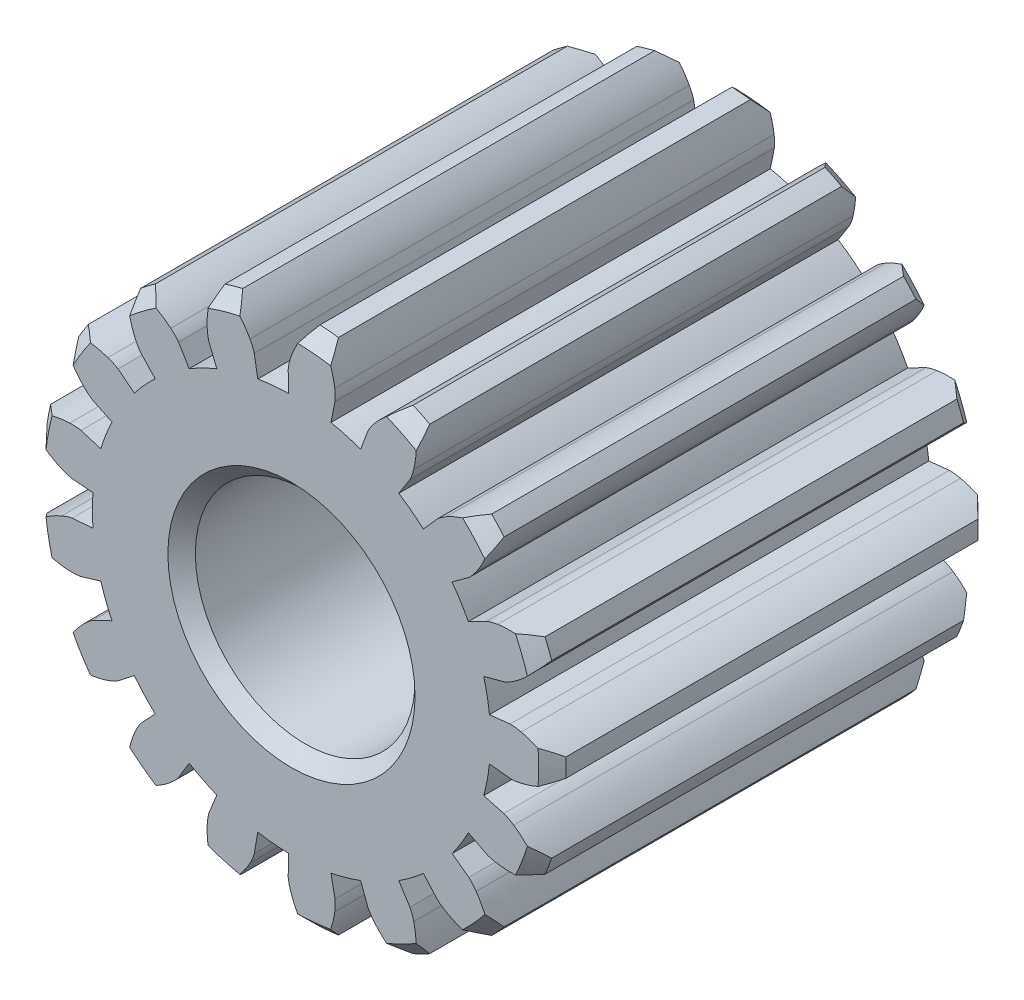
from build123d import *

# Parameters (mm, degrees)
MODEL_R             = 2
BOSS_EXTRUDE1_DEPTH = 8
CHAMFER1_SIZE       = 0.25
CHAMFER2_SIZE       = 0.25


with BuildPart() as part:
    # Model → Boss-Extrude1 (new body)
    with BuildSketch(Plane.XY):
        with BuildLine():
            Line((3.604185328, -0.387908651), (3.979276599, -0.428278703))
            add(Edge.make_bspline(
                [(3.979276599, -0.428278703), (4.001745096, -0.429226432), (4.069327024, -0.429175741), (4.182275047, -0.404282392)],
                knots=[0, 0, 0, 0, 1, 1, 1, 1], degree=3))
            add(Edge.make_bspline(
                [(4.182275047, -0.404282392), (4.317212789, -0.374010467), (4.510838803, -0.308553994), (4.747597513, -0.168282073)],
                knots=[0, 0, 0, 0, 1, 1, 1, 1], degree=3))
            ThreePointArc((4.747597513, -0.168282073), (4.750579017, 0), (4.747597513, 0.168282073))
            add(Edge.make_bspline(
                [(4.747597513, 0.168282073), (4.510838803, 0.308553994), (4.317212789, 0.374010467), (4.182275047, 0.404282392)],
                knots=[0, 0, 0, 0, 1, 1, 1, 1], degree=3))
            add(Edge.make_bspline(
                [(4.182275047, 0.404282392), (4.069327024, 0.429175741), (4.001745096, 0.429226432), (3.979276599, 0.428278703)],
                knots=[0, 0, 0, 0, 1, 1, 1, 1], degree=3))
            Line((3.979276599, 0.428278703), (3.604185328, 0.387908651))
            ThreePointArc((3.604185328, 0.387908651), (3.563277486, 0.666092002), (3.500931495, 0.940267868))
            Line((3.500931495, 0.940267868), (3.865277034, 1.038122512))
            add(Edge.make_bspline(
                [(3.865277034, 1.038122512), (3.886570643, 1.045355338), (3.949570602, 1.069816015), (4.045898982, 1.133829903)],
                knots=[0, 0, 0, 0, 1, 1, 1, 1], degree=3))
            add(Edge.make_bspline(
                [(4.045898982, 1.133829903), (4.160789199, 1.210802767), (4.317694474, 1.341784894), (4.487793334, 1.558111676)],
                knots=[0, 0, 0, 0, 1, 1, 1, 1], degree=3))
            ThreePointArc((4.487793334, 1.558111676), (4.429783007, 1.71610708), (4.366212341, 1.871948396))
            add(Edge.make_bspline(
                [(4.366212341, 1.871948396), (4.094769356, 1.917220956), (3.89057287, 1.908311516), (3.753811692, 1.88779411)],
                knots=[0, 0, 0, 0, 1, 1, 1, 1], degree=3))
            add(Edge.make_bspline(
                [(3.753811692, 1.88779411), (3.639498283, 1.870204934), (3.576461699, 1.845838794), (3.55585281, 1.836838506)],
                knots=[0, 0, 0, 0, 1, 1, 1, 1], degree=3))
            Line((3.55585281, 1.836838506), (3.220673961, 1.663695958))
            ThreePointArc((3.220673961, 1.663695958), (3.082037117, 1.90831659), (2.924857465, 2.141456002))
            Line((2.924857465, 2.141456002), (3.229250388, 2.364319529))
            add(Edge.make_bspline(
                [(3.229250388, 2.364319529), (3.246493288, 2.378756077), (3.296402785, 2.424323189), (3.363101841, 2.518812187)],
                knots=[0, 0, 0, 0, 1, 1, 1, 1], degree=3))
            add(Edge.make_bspline(
                [(3.363101841, 2.518812187), (3.442427971, 2.632090378), (3.541421581, 2.810908298), (3.621887797, 3.07407381)],
                knots=[0, 0, 0, 0, 1, 1, 1, 1], degree=3))
            ThreePointArc((3.621887797, 3.07407381), (3.510720256, 3.200444389), (3.395145998, 3.322797715))
            add(Edge.make_bspline(
                [(3.395145998, 3.322797715), (3.125678618, 3.266956604), (2.938489526, 3.184884519), (2.818375267, 3.116348773)],
                knots=[0, 0, 0, 0, 1, 1, 1, 1], degree=3))
            add(Edge.make_bspline(
                [(2.818375267, 3.116348773), (2.718135131, 3.058652588), (2.668157332, 3.013160399), (2.652191395, 2.997323091)],
                knots=[0, 0, 0, 0, 1, 1, 1, 1], degree=3))
            Line((2.652191395, 2.997323091), (2.402192728, 2.714791907))
            ThreePointArc((2.402192728, 2.714791907), (2.184550557, 2.892812449), (1.953765227, 3.053428637))
            Line((1.953765227, 3.053428637), (2.157095582, 3.371202093))
            add(Edge.make_bspline(
                [(2.157095582, 3.371202093), (2.167959025, 3.390892627), (2.198037506, 3.451412083), (2.22609916, 3.563614928)],
                knots=[0, 0, 0, 0, 1, 1, 1, 1], degree=3))
            add(Edge.make_bspline(
                [(2.22609916, 3.563614928), (2.259147771, 3.697899599), (2.28686008, 3.90040296), (2.266826244, 4.174865241)],
                knots=[0, 0, 0, 0, 1, 1, 1, 1], degree=3))
            ThreePointArc((2.266826244, 4.174865241), (2.11751528, 4.252543949), (1.965546375, 4.32488479))
            add(Edge.make_bspline(
                [(1.965546375, 4.32488479), (1.734447662, 4.175471659), (1.589546889, 4.031321221), (1.502301646, 3.924023265)],
                knots=[0, 0, 0, 0, 1, 1, 1, 1], degree=3))
            add(Edge.make_bspline(
                [(1.502301646, 3.924023265), (1.429672768, 3.834012262), (1.399503533, 3.773537995), (1.390336835, 3.753002583)],
                knots=[0, 0, 0, 0, 1, 1, 1, 1], degree=3))
            Line((1.390336835, 3.753002583), (1.259282057, 3.399240165))
            ThreePointArc((1.259282057, 3.399240165), (0.992028339, 3.486617957), (0.718806169, 3.553018814))
            Line((0.718806169, 3.553018814), (0.793613065, 3.922785134))
            add(Edge.make_bspline(
                [(0.793613065, 3.922785134), (0.796629883, 3.945070338), (0.802815081, 4.012368651), (0.788449452, 4.127131726)],
                knots=[0, 0, 0, 0, 1, 1, 1, 1], degree=3))
            add(Edge.make_bspline(
                [(0.788449452, 4.127131726), (0.770757146, 4.264286988), (0.723445453, 4.463126589), (0.605617245, 4.711817988)],
                knots=[0, 0, 0, 0, 1, 1, 1, 1], degree=3))
            ThreePointArc((0.605617245, 4.711817988), (0.438328132, 4.730313885), (0.270488822, 4.74287221))
            add(Edge.make_bspline(
                [(0.270488822, 4.74287221), (0.108969939, 4.520066131), (0.025927137, 4.333305653), (-0.016666138, 4.201736672)],
                knots=[0, 0, 0, 0, 1, 1, 1, 1], degree=3))
            add(Edge.make_bspline(
                [(-0.016666138, 4.201736672), (-0.051874824, 4.091567334), (-0.058160973, 4.024278375), (-0.059290418, 4.00181828)],
                knots=[0, 0, 0, 0, 1, 1, 1, 1], degree=3))
            Line((-0.059290418, 4.00181828), (-0.053701634, 3.624602204))
            ThreePointArc((-0.053701634, 3.624602204), (-0.334472803, 3.609536389), (-0.613231646, 3.572754113))
            Line((-0.613231646, 3.572754113), (-0.677051293, 3.944574305))
            add(Edge.make_bspline(
                [(-0.677051293, 3.944574305), (-0.682288539, 3.966444439), (-0.700831968, 4.031432599), (-0.755684723, 4.133256515)],
                knots=[0, 0, 0, 0, 1, 1, 1, 1], degree=3))
            add(Edge.make_bspline(
                [(-0.755684723, 4.133256515), (-0.821728502, 4.254758791), (-0.937674491, 4.423080241), (-1.137383718, 4.612413607)],
                knots=[0, 0, 0, 0, 1, 1, 1, 1], degree=3))
            ThreePointArc((-1.137383718, 4.612413607), (-1.300057658, 4.569228719), (-1.461099744, 4.520308456))
            add(Edge.make_bspline(
                [(-1.461099744, 4.520308456), (-1.531224778, 4.254200624), (-1.541194219, 4.050053145), (-1.533383067, 3.911982259)],
                knots=[0, 0, 0, 0, 1, 1, 1, 1], degree=3))
            add(Edge.make_bspline(
                [(-1.533383067, 3.911982259), (-1.526416434, 3.796533566), (-1.507970518, 3.731517662), (-1.500910172, 3.710166244)],
                knots=[0, 0, 0, 0, 1, 1, 1, 1], degree=3))
            Line((-1.500910172, 3.710166244), (-1.359432621, 3.36044163))
            ThreePointArc((-1.359432621, 3.36044163), (-1.61580154, 3.244966931), (-1.862449128, 3.109969171))
            Line((-1.862449128, 3.109969171), (-2.056276123, 3.433626859))
            add(Edge.make_bspline(
                [(-2.056276123, 3.433626859), (-2.069060113, 3.452128241), (-2.109827777, 3.506029235), (-2.197759488, 3.581162109)],
                knots=[0, 0, 0, 0, 1, 1, 1, 1], degree=3))
            add(Edge.make_bspline(
                [(-2.197759488, 3.581162109), (-2.303235163, 3.670601842), (-2.472156299, 3.785672398), (-2.726774707, 3.890077209)],
                knots=[0, 0, 0, 0, 1, 1, 1, 1], degree=3))
            ThreePointArc((-2.726774707, 3.890077209), (-2.862863459, 3.791043895), (-2.995358694, 3.687251997))
            add(Edge.make_bspline(
                [(-2.995358694, 3.687251997), (-2.964619104, 3.41378175), (-2.900168756, 3.219818518), (-2.843008116, 3.093892964)],
                knots=[0, 0, 0, 0, 1, 1, 1, 1], degree=3))
            add(Edge.make_bspline(
                [(-2.843008116, 3.093892964), (-2.794807046, 2.988756902), (-2.754120288, 2.93479481), (-2.73982369, 2.917435698)],
                knots=[0, 0, 0, 0, 1, 1, 1, 1], degree=3))
            Line((-2.73982369, 2.917435698), (-2.481564701, 2.642434793))
            ThreePointArc((-2.481564701, 2.642434793), (-2.678907325, 2.442146708), (-2.860132536, 2.22716566))
            Line((-2.860132536, 2.22716566), (-3.157789469, 2.458949079))
            add(Edge.make_bspline(
                [(-3.157789469, 2.458949079), (-3.176393654, 2.471582994), (-3.233879653, 2.507117196), (-3.343014657, 2.545411916)],
                knots=[0, 0, 0, 0, 1, 1, 1, 1], degree=3))
            add(Edge.make_bspline(
                [(-3.343014657, 2.545411916), (-3.473677153, 2.590709775), (-3.6727597, 2.63698852), (-3.947899663, 2.642364329)],
                knots=[0, 0, 0, 0, 1, 1, 1, 1], degree=3))
            ThreePointArc((-3.947899663, 2.642364329), (-4.039023685, 2.500857587), (-4.125077855, 2.356211725))
            add(Edge.make_bspline(
                [(-4.125077855, 2.356211725), (-3.997625193, 2.112312734), (-3.867459431, 1.954729558), (-3.768669166, 1.857956281)],
                knots=[0, 0, 0, 0, 1, 1, 1, 1], degree=3))
            add(Edge.make_bspline(
                [(-3.768669166, 1.857956281), (-3.68574348, 1.777332058), (-3.628310852, 1.741711658), (-3.608708837, 1.730689295)],
                knots=[0, 0, 0, 0, 1, 1, 1, 1], degree=3))
            Line((-3.608708837, 1.730689295), (-3.268547716, 1.567552495))
            ThreePointArc((-3.268547716, 1.567552495), (-3.380211832, 1.30950104), (-3.471539196, 1.043571085))
            Line((-3.471539196, 1.043571085), (-3.832825848, 1.152176601))
            add(Edge.make_bspline(
                [(-3.832825848, 1.152176601), (-3.854737631, 1.157236769), (-3.921178163, 1.169605087), (-4.036777172, 1.16588974)],
                knots=[0, 0, 0, 0, 1, 1, 1, 1], degree=3))
            add(Edge.make_bspline(
                [(-4.036777172, 1.16588974), (-4.174979794, 1.160927997), (-4.377336553, 1.132164731), (-4.635838893, 1.037785505)],
                knots=[0, 0, 0, 0, 1, 1, 1, 1], degree=3))
            ThreePointArc((-4.635838893, 1.037785505), (-4.669691382, 0.872916604), (-4.697682393, 0.706952003))
            add(Edge.make_bspline(
                [(-4.697682393, 0.706952003), (-4.490729848, 0.525564179), (-4.31242828, 0.42564354), (-4.185350561, 0.371092307)],
                knots=[0, 0, 0, 0, 1, 1, 1, 1], degree=3))
            add(Edge.make_bspline(
                [(-4.185350561, 0.371092307), (-4.078899834, 0.32586867), (-4.012477931, 0.313400695), (-3.990217859, 0.310203712)],
                knots=[0, 0, 0, 0, 1, 1, 1, 1], degree=3))
            Line((-3.990217859, 0.310203712), (-3.614095251, 0.280963547))
            ThreePointArc((-3.614095251, 0.280963547), (-3.625, 0), (-3.614095251, -0.280963547))
            Line((-3.614095251, -0.280963547), (-3.990217859, -0.310203712))
            add(Edge.make_bspline(
                [(-3.990217859, -0.310203712), (-4.012477931, -0.313400695), (-4.078899834, -0.32586867), (-4.185350561, -0.371092307)],
                knots=[0, 0, 0, 0, 1, 1, 1, 1], degree=3))
            add(Edge.make_bspline(
                [(-4.185350561, -0.371092307), (-4.31242828, -0.42564354), (-4.490729848, -0.525564179), (-4.697682393, -0.706952003)],
                knots=[0, 0, 0, 0, 1, 1, 1, 1], degree=3))
            ThreePointArc((-4.697682393, -0.706952003), (-4.669691382, -0.872916604), (-4.635838893, -1.037785505))
            add(Edge.make_bspline(
                [(-4.635838893, -1.037785505), (-4.377336553, -1.132164731), (-4.174979794, -1.160927997), (-4.036777172, -1.16588974)],
                knots=[0, 0, 0, 0, 1, 1, 1, 1], degree=3))
            add(Edge.make_bspline(
                [(-4.036777172, -1.16588974), (-3.921178163, -1.169605087), (-3.854737631, -1.157236769), (-3.832825848, -1.152176601)],
                knots=[0, 0, 0, 0, 1, 1, 1, 1], degree=3))
            Line((-3.832825848, -1.152176601), (-3.471539196, -1.043571085))
            ThreePointArc((-3.471539196, -1.043571085), (-3.380211832, -1.30950104), (-3.268547716, -1.567552495))
            Line((-3.268547716, -1.567552495), (-3.608708837, -1.730689295))
            add(Edge.make_bspline(
                [(-3.608708837, -1.730689295), (-3.628310852, -1.741711658), (-3.68574348, -1.777332058), (-3.768669166, -1.857956281)],
                knots=[0, 0, 0, 0, 1, 1, 1, 1], degree=3))
            add(Edge.make_bspline(
                [(-3.768669166, -1.857956281), (-3.867459431, -1.954729558), (-3.997625193, -2.112312734), (-4.125077855, -2.356211725)],
                knots=[0, 0, 0, 0, 1, 1, 1, 1], degree=3))
            ThreePointArc((-4.125077855, -2.356211725), (-4.039023685, -2.500857587), (-3.947899663, -2.642364329))
            add(Edge.make_bspline(
                [(-3.947899663, -2.642364329), (-3.6727597, -2.63698852), (-3.473677153, -2.590709775), (-3.343014657, -2.545411916)],
                knots=[0, 0, 0, 0, 1, 1, 1, 1], degree=3))
            add(Edge.make_bspline(
                [(-3.343014657, -2.545411916), (-3.233879653, -2.507117196), (-3.176393654, -2.471582994), (-3.157789469, -2.458949079)],
                knots=[0, 0, 0, 0, 1, 1, 1, 1], degree=3))
            Line((-3.157789469, -2.458949079), (-2.860132536, -2.22716566))
            ThreePointArc((-2.860132536, -2.22716566), (-2.678907325, -2.442146708), (-2.481564701, -2.642434793))
            Line((-2.481564701, -2.642434793), (-2.73982369, -2.917435698))
            add(Edge.make_bspline(
                [(-2.73982369, -2.917435698), (-2.754120288, -2.93479481), (-2.794807046, -2.988756902), (-2.843008116, -3.093892964)],
                knots=[0, 0, 0, 0, 1, 1, 1, 1], degree=3))
            add(Edge.make_bspline(
                [(-2.843008116, -3.093892964), (-2.900168756, -3.219818518), (-2.964619104, -3.41378175), (-2.995358694, -3.687251997)],
                knots=[0, 0, 0, 0, 1, 1, 1, 1], degree=3))
            ThreePointArc((-2.995358694, -3.687251997), (-2.862863459, -3.791043895), (-2.726774707, -3.890077209))
            add(Edge.make_bspline(
                [(-2.726774707, -3.890077209), (-2.472156299, -3.785672398), (-2.303235163, -3.670601842), (-2.197759488, -3.581162109)],
                knots=[0, 0, 0, 0, 1, 1, 1, 1], degree=3))
            add(Edge.make_bspline(
                [(-2.197759488, -3.581162109), (-2.109827777, -3.506029235), (-2.069060113, -3.452128241), (-2.056276123, -3.433626859)],
                knots=[0, 0, 0, 0, 1, 1, 1, 1], degree=3))
            Line((-2.056276123, -3.433626859), (-1.862449128, -3.109969171))
            ThreePointArc((-1.862449128, -3.109969171), (-1.61580154, -3.244966931), (-1.359432621, -3.36044163))
            Line((-1.359432621, -3.36044163), (-1.500910172, -3.710166244))
            add(Edge.make_bspline(
                [(-1.500910172, -3.710166244), (-1.507970518, -3.731517662), (-1.526416434, -3.796533566), (-1.533383067, -3.911982259)],
                knots=[0, 0, 0, 0, 1, 1, 1, 1], degree=3))
            add(Edge.make_bspline(
                [(-1.533383067, -3.911982259), (-1.541194219, -4.050053145), (-1.531224778, -4.254200624), (-1.461099744, -4.520308456)],
                knots=[0, 0, 0, 0, 1, 1, 1, 1], degree=3))
            ThreePointArc((-1.461099744, -4.520308456), (-1.300057658, -4.569228719), (-1.137383718, -4.612413607))
            add(Edge.make_bspline(
                [(-1.137383718, -4.612413607), (-0.937674491, -4.423080241), (-0.821728502, -4.254758791), (-0.755684723, -4.133256515)],
                knots=[0, 0, 0, 0, 1, 1, 1, 1], degree=3))
            add(Edge.make_bspline(
                [(-0.755684723, -4.133256515), (-0.700831968, -4.031432599), (-0.682288539, -3.966444439), (-0.677051293, -3.944574305)],
                knots=[0, 0, 0, 0, 1, 1, 1, 1], degree=3))
            Line((-0.677051293, -3.944574305), (-0.613231646, -3.572754113))
            ThreePointArc((-0.613231646, -3.572754113), (-0.334472803, -3.609536389), (-0.053701634, -3.624602204))
            Line((-0.053701634, -3.624602204), (-0.059290418, -4.00181828))
            add(Edge.make_bspline(
                [(-0.059290418, -4.00181828), (-0.058160973, -4.024278375), (-0.051874824, -4.091567334), (-0.016666138, -4.201736672)],
                knots=[0, 0, 0, 0, 1, 1, 1, 1], degree=3))
            add(Edge.make_bspline(
                [(-0.016666138, -4.201736672), (0.025927137, -4.333305653), (0.108969939, -4.520066131), (0.270488822, -4.74287221)],
                knots=[0, 0, 0, 0, 1, 1, 1, 1], degree=3))
            ThreePointArc((0.270488822, -4.74287221), (0.438328132, -4.730313885), (0.605617245, -4.711817988))
            add(Edge.make_bspline(
                [(0.605617245, -4.711817988), (0.723445453, -4.463126589), (0.770757146, -4.264286988), (0.788449452, -4.127131726)],
                knots=[0, 0, 0, 0, 1, 1, 1, 1], degree=3))
            add(Edge.make_bspline(
                [(0.788449452, -4.127131726), (0.802815081, -4.012368651), (0.796629883, -3.945070338), (0.793613065, -3.922785134)],
                knots=[0, 0, 0, 0, 1, 1, 1, 1], degree=3))
            Line((0.793613065, -3.922785134), (0.718806169, -3.553018814))
            ThreePointArc((0.718806169, -3.553018814), (0.992028339, -3.486617957), (1.259282057, -3.399240165))
            Line((1.259282057, -3.399240165), (1.390336835, -3.753002583))
            add(Edge.make_bspline(
                [(1.390336835, -3.753002583), (1.399503533, -3.773537995), (1.429672768, -3.834012262), (1.502301646, -3.924023265)],
                knots=[0, 0, 0, 0, 1, 1, 1, 1], degree=3))
            add(Edge.make_bspline(
                [(1.502301646, -3.924023265), (1.589546889, -4.031321221), (1.734447662, -4.175471659), (1.965546375, -4.32488479)],
                knots=[0, 0, 0, 0, 1, 1, 1, 1], degree=3))
            ThreePointArc((1.965546375, -4.32488479), (2.11751528, -4.252543949), (2.266826244, -4.174865241))
            add(Edge.make_bspline(
                [(2.266826244, -4.174865241), (2.28686008, -3.90040296), (2.259147771, -3.697899599), (2.22609916, -3.563614928)],
                knots=[0, 0, 0, 0, 1, 1, 1, 1], degree=3))
            add(Edge.make_bspline(
                [(2.22609916, -3.563614928), (2.198037506, -3.451412083), (2.167959025, -3.390892627), (2.157095582, -3.371202093)],
                knots=[0, 0, 0, 0, 1, 1, 1, 1], degree=3))
            Line((2.157095582, -3.371202093), (1.953765227, -3.053428637))
            ThreePointArc((1.953765227, -3.053428637), (2.184550557, -2.892812449), (2.402192728, -2.714791907))
            Line((2.402192728, -2.714791907), (2.652191395, -2.997323091))
            add(Edge.make_bspline(
                [(2.652191395, -2.997323091), (2.668157332, -3.013160399), (2.718135131, -3.058652588), (2.818375267, -3.116348773)],
                knots=[0, 0, 0, 0, 1, 1, 1, 1], degree=3))
            add(Edge.make_bspline(
                [(2.818375267, -3.116348773), (2.938489526, -3.184884519), (3.125678618, -3.266956604), (3.395145998, -3.322797715)],
                knots=[0, 0, 0, 0, 1, 1, 1, 1], degree=3))
            ThreePointArc((3.395145998, -3.322797715), (3.510720256, -3.200444389), (3.621887797, -3.07407381))
            add(Edge.make_bspline(
                [(3.621887797, -3.07407381), (3.541421581, -2.810908298), (3.442427971, -2.632090378), (3.363101841, -2.518812187)],
                knots=[0, 0, 0, 0, 1, 1, 1, 1], degree=3))
            add(Edge.make_bspline(
                [(3.363101841, -2.518812187), (3.296402785, -2.424323189), (3.246493288, -2.378756077), (3.229250388, -2.364319529)],
                knots=[0, 0, 0, 0, 1, 1, 1, 1], degree=3))
            Line((3.229250388, -2.364319529), (2.924857465, -2.141456002))
            ThreePointArc((2.924857465, -2.141456002), (3.082037117, -1.90831659), (3.220673961, -1.663695958))
            Line((3.220673961, -1.663695958), (3.55585281, -1.836838506))
            add(Edge.make_bspline(
                [(3.55585281, -1.836838506), (3.576461699, -1.845838794), (3.639498283, -1.870204934), (3.753811692, -1.88779411)],
                knots=[0, 0, 0, 0, 1, 1, 1, 1], degree=3))
            add(Edge.make_bspline(
                [(3.753811692, -1.88779411), (3.89057287, -1.908311516), (4.094769356, -1.917220956), (4.366212341, -1.871948396)],
                knots=[0, 0, 0, 0, 1, 1, 1, 1], degree=3))
            ThreePointArc((4.366212341, -1.871948396), (4.429783007, -1.71610708), (4.487793334, -1.558111676))
            add(Edge.make_bspline(
                [(4.487793334, -1.558111676), (4.317694474, -1.341784894), (4.160789199, -1.210802767), (4.045898982, -1.133829903)],
                knots=[0, 0, 0, 0, 1, 1, 1, 1], degree=3))
            add(Edge.make_bspline(
                [(4.045898982, -1.133829903), (3.949570602, -1.069816015), (3.886570643, -1.045355338), (3.865277034, -1.038122512)],
                knots=[0, 0, 0, 0, 1, 1, 1, 1], degree=3))
            Line((3.865277034, -1.038122512), (3.500931495, -0.940267868))
            ThreePointArc((3.500931495, -0.940267868), (3.563277486, -0.666092002), (3.604185328, -0.387908651))
        make_face()
        Circle(MODEL_R, mode=Mode.SUBTRACT)
    extrude(amount=BOSS_EXTRUDE1_DEPTH)

    # Chamfer1
    chamfer1_edges = [part.edges().sort_by_distance(p)[0] for p in [
        (-2, 0, 8),
        (4.429783007, 1.71610708, 8),
        (4.750579017, 0, 8),
        (4.429783007, -1.71610708, 8),
        (3.510720256, -3.200444389, 8),
        (2.11751528, -4.252543949, 8),
        (0.438328132, -4.730313885, 8),
        (-1.300057658, -4.569228719, 8),
        (-2.862863459, -3.791043895, 8),
        (-4.039023685, -2.500857587, 8),
        (-4.669691382, -0.872916604, 8),
        (-4.669691382, 0.872916604, 8),
        (-4.039023685, 2.500857587, 8),
        (-2.862863459, 3.791043895, 8),
        (3.510720256, 3.200444389, 8),
        (2.11751528, 4.252543949, 8),
        (0.438328132, 4.730313885, 8),
        (-1.300057658, 4.569228719, 8),
    ]]
    chamfer(chamfer1_edges, length=CHAMFER1_SIZE)

    # Chamfer2
    chamfer2_edges = [part.edges().sort_by_distance(p)[0] for p in [
        (-2, 0, 0),
        (-1.300057658, 4.569228719, 0),
        (0.438328132, 4.730313885, 0),
        (2.11751528, 4.252543949, 0),
        (3.510720256, 3.200444389, 0),
        (4.429783007, 1.71610708, 0),
        (4.750579017, 0, 0),
        (4.429783007, -1.71610708, 0),
        (3.510720256, -3.200444389, 0),
        (2.11751528, -4.252543949, 0),
        (0.438328132, -4.730313885, 0),
        (-1.300057658, -4.569228719, 0),
        (-2.862863459, -3.791043895, 0),
        (-4.039023685, -2.500857587, 0),
        (-4.669691382, -0.872916604, 0),
        (-4.669691382, 0.872916604, 0),
        (-4.039023685, 2.500857587, 0),
        (-2.862863459, 3.791043895, 0),
    ]]
    chamfer(chamfer2_edges, length=CHAMFER2_SIZE)


solid = part.part
